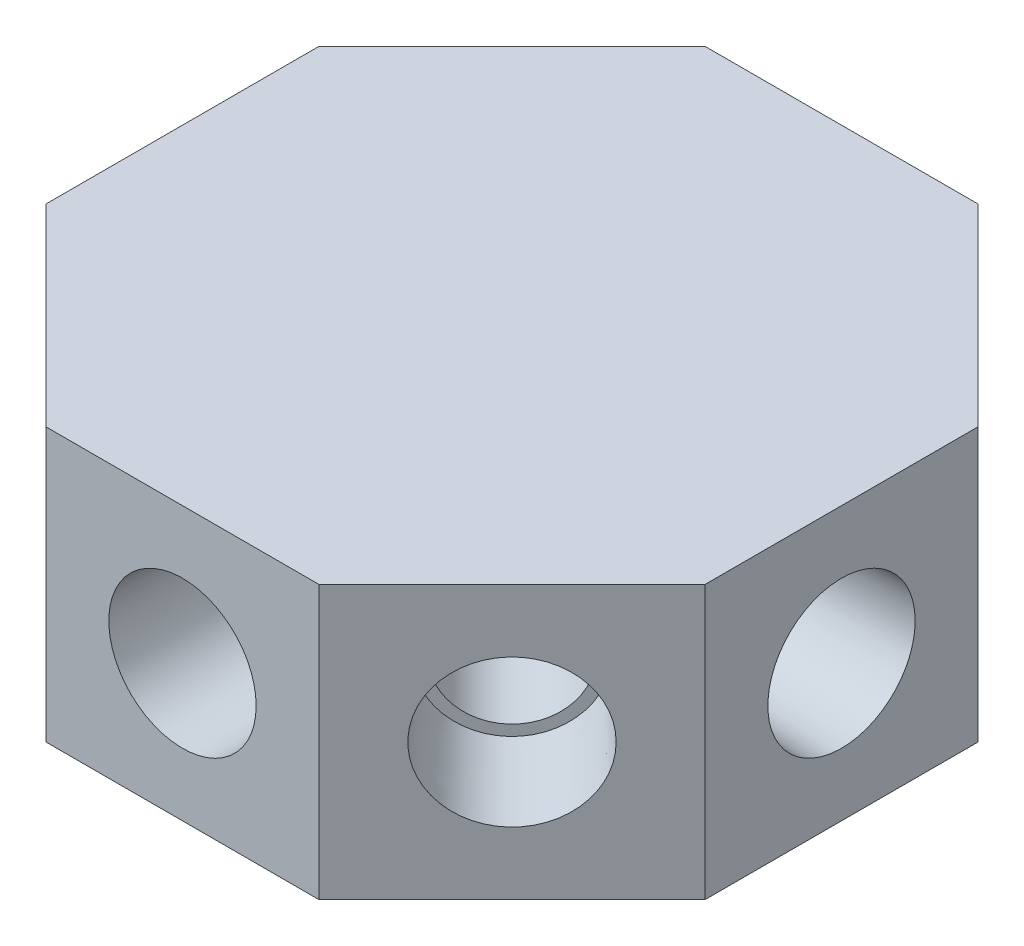
from build123d import *

# Parameters (mm, degrees)
BOSS_EXTRUDE1_DEPTH = 25.4
CUT_EXTRUDE2_REACH  = 80.258
SKETCH7_R           = 5.5626
CIRPATTERN1_COUNT   = 8


with BuildPart() as part:
    # Sketch1 → Boss-Extrude1 (new body)
    with BuildSketch(Plane(origin=(0, 0, 0), x_dir=(1, 0, 0), z_dir=(0, 1, 0))):
        Polygon((12.7, -30.660512242), (30.660512242, -12.7), (30.660512242, 12.7), (12.7, 30.660512242), (-12.7, 30.660512242), (-30.660512242, 12.7), (-30.660512242, -12.7), (-12.7, -30.660512242), align=None)
    extrude(amount=BOSS_EXTRUDE1_DEPTH)

    # Sketch2 → 1/4 NPT Tapped Hole1 (revolve, cut)
    with BuildSketch(Plane(origin=(0, 0, 0), x_dir=(0, 0, -1), z_dir=(1, 0, 0))):
        Polygon((0, 0), (0, 20.360347279), (5.5626, 17.018), (5.5626, 9.906), (6.557984794, 9.906), (6.8545837, 0), align=None)
    revolve(axis=Axis((0, -6.35, 0), (0, 1, 0)), mode=Mode.SUBTRACT)

    # Sketch4 → 1/4 NPT Tapped Hole2 (revolve, cut)
    with BuildSketch(Plane(origin=(-21.680256121, 12.7, 21.680256121), x_dir=(0.7071067811865474, 0, 0.7071067811865477), z_dir=(0, 1, 0))):
        Polygon((0, 0), (0, 20.360347279), (5.5626, 17.018), (5.5626, 9.906), (6.557984794, 9.906), (6.8545837, 0), align=None)
    f_1_4_npt_tapped_hole2 = revolve(axis=Axis((-26.170384182, 12.7, 26.170384182), (0.7071067811865477, 0, -0.7071067811865474)), mode=Mode.SUBTRACT)

    # Sketch7 → Cut-Extrude2 (cut, up to next)
    with BuildSketch(Plane(origin=(-21.680256121, 0, 21.680256121), x_dir=(0.7071067811865474, 0, 0.7071067811865477), z_dir=(-0.7071067811865477, 0, 0.7071067811865474)), mode=Mode.PRIVATE) as cut_extrude2_sk1:
        with Locations((0, 12.7)):
            Circle(SKETCH7_R)
    cut_extrude2_tool1 = extrude(cut_extrude2_sk1.sketch, amount=-CUT_EXTRUDE2_REACH, mode=Mode.PRIVATE) & part.part
    cut_extrude2 = cut_extrude2_tool1.solids().sort_by_distance((-21.680256, 12.7, 21.680256))[0]
    add(cut_extrude2, mode=Mode.SUBTRACT)

    # CirPattern1: 1/4 NPT Tapped Hole2, Cut-Extrude2 ×8 about axis
    cirpattern1_axis = Axis((0, 0, 0), (0, 1, 0))
    add([f_1_4_npt_tapped_hole2.rotate(cirpattern1_axis, i * 360 / CIRPATTERN1_COUNT) for i in range(1, CIRPATTERN1_COUNT)], mode=Mode.SUBTRACT)
    add([cut_extrude2.rotate(cirpattern1_axis, i * 360 / CIRPATTERN1_COUNT) for i in range(1, CIRPATTERN1_COUNT)], mode=Mode.SUBTRACT)


solid = part.part
